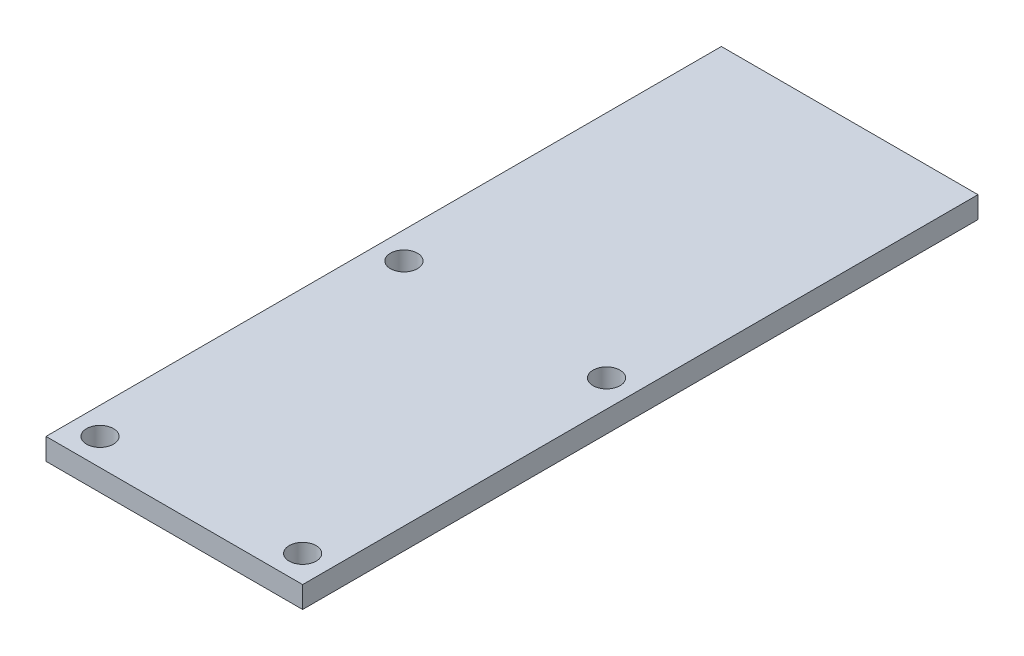
from build123d import *

# Parameters (mm, degrees)
SKETCH1_W           = 19
SKETCH1_H           = 50
SKETCH1_R           = 1
BOSS_EXTRUDE1_DEPTH = 1.6


with BuildPart() as part:
    # Sketch1 → Boss-Extrude1 (new body)
    with BuildSketch(Plane(origin=(0, 0, 0), x_dir=(1, 0, 0), z_dir=(0, 1, 0))):
        with Locations((9.5, 25)):
            Rectangle(SKETCH1_W, SKETCH1_H)
        with Locations(Location((2, 2, 0), (0, 0, 270))):
            Circle(SKETCH1_R, mode=Mode.SUBTRACT)
        with Locations(Location((2, 24.5, 0), (0, 0, 270))):
            Circle(SKETCH1_R, mode=Mode.SUBTRACT)
        with Locations(Location((17, 24.5, 0), (0, 0, 270))):
            Circle(SKETCH1_R, mode=Mode.SUBTRACT)
        with Locations(Location((17, 2, 0), (0, 0, 270))):
            Circle(SKETCH1_R, mode=Mode.SUBTRACT)
    extrude(amount=BOSS_EXTRUDE1_DEPTH)


solid = part.part
